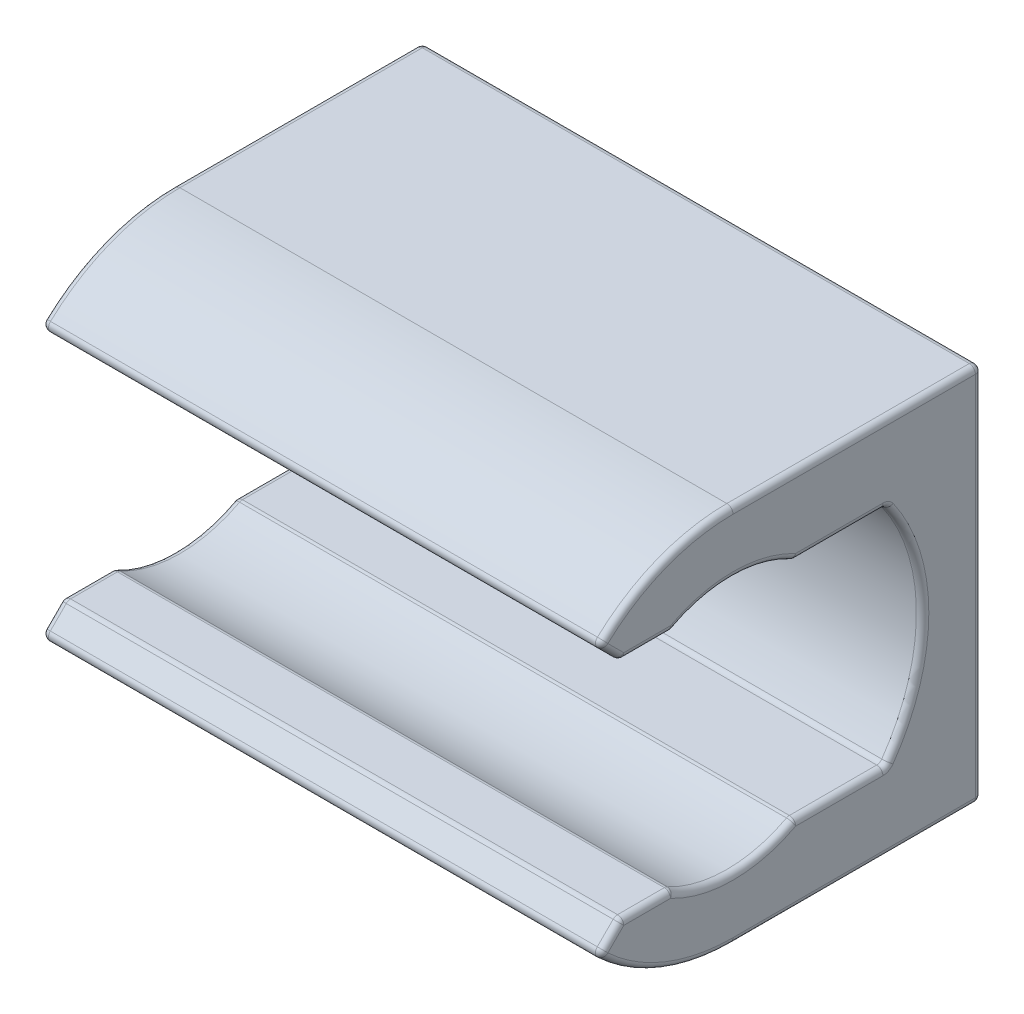
from build123d import *

# Parameters (mm, degrees)
BOSS_EXTRUDE1_DEPTH = 18
FILLET1_R           = 0.2


with BuildPart() as part:
    # Sketch1 → Boss-Extrude1 (new body)
    with BuildSketch(Plane(origin=(0, 0, 0), x_dir=(0, 0, -1), z_dir=(1, 0, 0))):
        with BuildLine():
            Line((-4.3133513652379465, 4.313351365237932), (-3.6000000000000107, 3.5999999999999988))
            Line((-3.6000000000000103, 3.5999999999999996), (-1.9621416870348378, 3.5999999999999996))
            ThreePointArc((-1.962141687034841, 3.6000000000000094), (-1.978e-14, 4.1), (1.962141687034806, 3.600000000000028))
            Line((1.9621416870347996, 3.5999999999999996), (4.924428900898164, 3.5999999999999996))
            ThreePointArc((4.9244289008981275, 3.5999999999998975), (4.632641104588721, 3.96845516493194), (4.3133513652379465, 4.313351365237932))
            ThreePointArc((4.3133513652379465, 4.313351365237932), (2.3343689374270524, 5.6356651483188465), (3.7e-16, 6.1))
            ThreePointArc((3.7e-16, 6.1), (-2.334368937427052, 5.6356651483188465), (-4.3133513652379465, 4.313351365237932))
        make_face()
        with BuildLine():
            Line((8, 6.1), (0, 6.1))
            ThreePointArc((3.7e-16, 6.1), (2.3343689374270524, 5.6356651483188465), (4.3133513652379465, 4.313351365237932))
            Line((4.3133513652379465, 4.313351365237932), (8, 4.313351365237933))
            Line((8, 4.313351365237933), (8, 6.1))
        make_face()
        with BuildLine():
            ThreePointArc((4.3133513652379465, 4.313351365237932), (4.632641104588721, 3.96845516493194), (4.9244289008981275, 3.5999999999998975))
            Line((4.924428900898164, 3.5999999999999996), (8, 3.5999999999999996))
            Line((8, 3.5999999999999996), (8, 4.313351365237933))
            Line((8, 4.313351365237933), (4.3133513652379465, 4.313351365237932))
        make_face()
        with BuildLine():
            Line((8, 3.5999999999999996), (4.924428900898164, 3.5999999999999996))
            ThreePointArc((4.9244289008981275, 3.5999999999998975), (5.7986643417031205, 1.8935395037497136), (6.1, 0))
            ThreePointArc((6.1, -1.49e-15), (5.7986643417031205, -1.8935395037497147), (4.924428900898127, -3.599999999999898))
            Line((4.924428900898162, -3.6), (8, -3.5999999999999996))
            Line((8, -3.5999999999999996), (8, 3.5999999999999996))
        make_face()
        with BuildLine():
            ThreePointArc((4.3133513652379465, -4.313351365237933), (2.334368937427049, -5.635665148318848), (-6.54e-15, -6.1))
            Line((-6.22e-15, -6.1), (8, -6.1))
            Line((8, -6.1), (8, -4.313351365237933))
            Line((8, -4.313351365237933), (4.3133513652379465, -4.313351365237932))
        make_face()
        with BuildLine():
            Line((8, -3.5999999999999996), (4.924428900898162, -3.6))
            ThreePointArc((4.924428900898127, -3.599999999999898), (4.6326411045887195, -3.968455164931942), (4.3133513652379465, -4.313351365237933))
            Line((4.3133513652379465, -4.313351365237932), (8, -4.313351365237933))
            Line((8, -4.313351365237933), (8, -3.5999999999999996))
        make_face()
        with BuildLine():
            Line((-1.9621416870348352, -3.6000000000000005), (-3.6000000000000156, -3.600000000000001))
            Line((-3.600000000000014, -3.6000000000000023), (-4.3133513652379465, -4.313351365237932))
            ThreePointArc((-4.313351365237948, -4.313351365237931), (-2.334368937427056, -5.635665148318846), (-6.54e-15, -6.1))
            ThreePointArc((-6.54e-15, -6.1), (2.334368937427049, -5.635665148318848), (4.3133513652379465, -4.313351365237933))
            ThreePointArc((4.3133513652379465, -4.313351365237933), (4.6326411045887195, -3.968455164931942), (4.924428900898127, -3.599999999999898))
            Line((4.924428900898162, -3.6), (1.9621416870348023, -3.6000000000000005))
            ThreePointArc((1.9621416870348085, -3.6000000000000267), (-1.532e-14, -4.1), (-1.9621416870348387, -3.6000000000000103))
        make_face()
    extrude(amount=BOSS_EXTRUDE1_DEPTH)

    # Fillet1
    fillet1_edges = [part.edges().sort_by_distance(p)[0] for p in [
        (0, -6.1, -3.9999999999999973),
        (0, -5.635665148318846, 2.334368937427055),
        (0, -3.9566756826189673, 3.95667568261898),
        (18, 6.1, -4),
        (0, -3.6000000000000005, 2.7810708435174254),
        (0, -4.1000000000000005, 1.654e-14),
        (0, -3.6, -3.443285293966482),
        (0, -6.1e-16, -6.100000000000001),
        (0, 3.6000000000000103, -3.4432852939664738),
        (0, 4.1, 1.982e-14),
        (0, 3.5999999999999996, 2.781070843517424),
        (0, 3.9566756826189655, 3.956675682618979),
        (0, 5.635665148318875, 2.334368937427066),
        (18, 5.6356651483188465, 2.334368937427051),
        (0, 6.1, -4),
        (0, 0, -8),
        (18, 3.9566756826189655, 3.956675682618979),
        (9, -6.1, -8),
        (9, -4.313351365237931, 4.313351365237947),
        (9, -3.6000000000000014, 3.6000000000000147),
        (9, -3.600000000000006, 1.9621416870348367),
        (9, -3.600000000000014, -1.9621416870348056),
        (9, -3.599999999999949, -4.924428900898144),
        (9, 3.599999999999948, -4.924428900898145),
        (9, 3.600000000000014, -1.9621416870348032),
        (9, 3.600000000000005, 1.9621416870348396),
        (9, 3.599999999999999, 3.6000000000000103),
        (9, 4.313351365237933, 4.313351365237946),
        (9, 6.1, -8),
        (18, 3.5999999999999996, 2.781070843517424),
        (18, 4.1, 1.982e-14),
        (18, 0, -8),
        (18, 3.6000000000000103, -3.4432852939664738),
        (18, -6.1e-16, -6.100000000000001),
        (18, -3.6, -3.443285293966482),
        (18, -4.1000000000000005, 1.654e-14),
        (18, -3.6000000000000005, 2.7810708435174254),
        (18, -3.9566756826189673, 3.95667568261898),
        (18, -5.635665148318815, 2.3343689374270387),
        (18, -6.1, -3.9999999999999973),
    ]]
    fillet(fillet1_edges, radius=FILLET1_R)


solid = part.part
